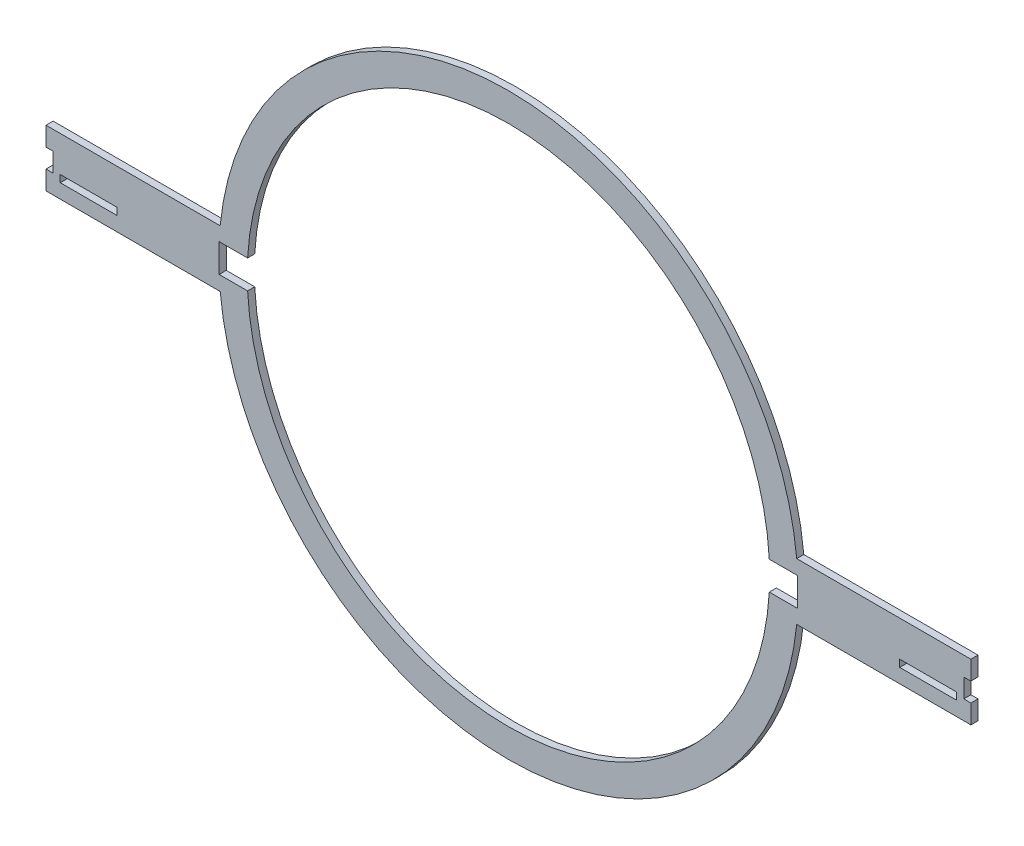
from build123d import *

# Parameters (mm, degrees)
SKETCH1_R           = 129.2733
SKETCH1_R_2         = 116.5733
BOSS_EXTRUDE1_DEPTH = 3.175
SKETCH2_W           = 3.175
SKETCH2_H           = 8.466666666
CUT_EXTRUDE1_DEPTH  = 3.175
CUT_EXTRUDE6_START  = -3.175
CUT_EXTRUDE6_DEPTH  = 3.175
SKETCH4_W           = 25.4
SKETCH4_H           = 3.175
CUT_EXTRUDE7_DEPTH  = 3.175


with BuildPart() as part:
    # Sketch1 → Boss-Extrude1 (new body)
    # profile 1 of 3: a face of its own
    with BuildSketch(Plane.XY):
        with BuildLine():
            Line((-206.375, -12.7), (-128.647954095, -12.7))
            ThreePointArc((-128.647954095, -12.7), (-129.2733, 0), (-128.647954095, 12.7))
            Line((-128.647954095, 12.7), (-206.375, 12.7))
            Line((-206.375, 12.7), (-206.375, -12.7))
        make_face()
    # profile 2 of 3: a face of its own
    with BuildSketch(Plane.XY):
        Circle(SKETCH1_R)
        Circle(SKETCH1_R_2, mode=Mode.SUBTRACT)
    # profile 3 of 3: a face of its own
    with BuildSketch(Plane.XY):
        with BuildLine():
            ThreePointArc((129.2733, 0), (129.116868877, -6.357693322), (128.647954095, -12.7))
            Line((128.647954095, -12.7), (206.375, -12.7))
            Line((206.375, -12.7), (206.375, 12.7))
            Line((206.375, 12.7), (128.647954095, 12.7))
            ThreePointArc((128.647954095, 12.7), (129.116868877, 6.357693322), (129.2733, 0))
        make_face()
    extrude(amount=BOSS_EXTRUDE1_DEPTH)

    # Sketch2 → Cut-Extrude1 (cut)
    with BuildSketch(Plane.XY.offset(3.175)):
        with Locations((-204.7875, 0)):
            Rectangle(SKETCH2_W, SKETCH2_H)
    cut_extrude1 = extrude(amount=-CUT_EXTRUDE1_DEPTH, mode=Mode.SUBTRACT)

    # Mirror1: Cut-Extrude1 across plane
    add(cut_extrude1.mirror(Plane(origin=(0, 0, 0), x_dir=(0, 0, 1), z_dir=(1, 0, 0))), mode=Mode.SUBTRACT)

    # Sketch3 → Cut-Extrude6 (cut)
    with BuildSketch(Plane.XY.offset(3.175).offset(CUT_EXTRUDE6_START)):
        with BuildLine():
            Line((-116.400222392, -6.35), (-129.100222392, -6.35))
            Line((-129.100222392, -6.35), (-129.100222392, 6.35))
            Line((-129.100222392, 6.35), (-116.400222392, 6.35))
            ThreePointArc((-116.400222392, 6.35), (-116.5733, 0), (-116.400222392, -6.35))
        make_face()
    cut_extrude6 = extrude(amount=CUT_EXTRUDE6_DEPTH, mode=Mode.SUBTRACT)

    # Mirror2: Cut-Extrude6 across plane
    add(cut_extrude6.mirror(Plane(origin=(0, 0, 0), x_dir=(0, 0, 1), z_dir=(1, 0, 0))), mode=Mode.SUBTRACT)

    # Sketch4 → Cut-Extrude7 (cut)
    with BuildSketch(Plane.XY.offset(3.175)):
        with Locations((187.325, -4.7625)):
            Rectangle(SKETCH4_W, SKETCH4_H)
    cut_extrude7 = extrude(amount=-CUT_EXTRUDE7_DEPTH, mode=Mode.SUBTRACT)

    # Mirror3: Cut-Extrude7 across plane
    add(cut_extrude7.mirror(Plane(origin=(0, 0, 0), x_dir=(0, 0, 1), z_dir=(1, 0, 0))), mode=Mode.SUBTRACT)


solid = part.part
